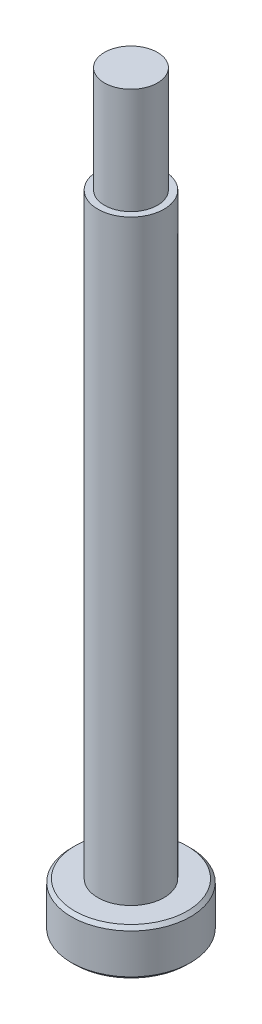
from build123d import *

# Parameters (mm, degrees)
SKETCH_1_R          = 4.5
EXTRUDE_1_DEPTH     = 3.5
SKETCH_2_R          = 2.5
EXTRUDE_2_DEPTH     = 45
SKETCH_3_R          = 2
EXTRUDE_3_DEPTH     = 8
CUT_EXTRUDE_1_DEPTH = 2.5
CHAMFER_1_SIZE      = 0.25


with BuildPart() as part:
    # 草图1 → 凸台-拉伸1 (new body)
    with BuildSketch(Plane(origin=(0, 0, 0), x_dir=(1, 0, 0), z_dir=(0, 1, 0))):
        with Locations(Location((0, 0, 0), (0, 0, 270))):
            Circle(SKETCH_1_R)
    extrude(amount=-EXTRUDE_1_DEPTH)

    # 草图2 → 凸台-拉伸2 (add)
    with BuildSketch(Plane(origin=(0, 0, 0), x_dir=(1, 0, 0), z_dir=(0, 1, 0))):
        with Locations(Location((0, 0, 0), (0, 0, 90))):
            Circle(SKETCH_2_R)
    extrude(amount=EXTRUDE_2_DEPTH)

    # 草图3 → 凸台-拉伸3 (add)
    with BuildSketch(Plane(origin=(0, 45, 0), x_dir=(1, 0, 0), z_dir=(0, 1, 0))):
        with Locations(Location((0, 0, 0), (0, 0, 270))):
            Circle(SKETCH_3_R)
    extrude(amount=EXTRUDE_3_DEPTH)

    # 草图4 → 切除-拉伸1 (cut)
    with BuildSketch(Plane.XZ.offset(3.5)):
        Polygon((1.5, -0.866025404), (1.5, 0.866025404), (0, 1.732050808), (-1.5, 0.866025404), (-1.5, -0.866025404), (0, -1.732050808), align=None)
    extrude(amount=-CUT_EXTRUDE_1_DEPTH, mode=Mode.SUBTRACT)

    # 倒角1
    chamfer_1_edges = [part.edges().sort_by_distance(p)[0] for p in [
        (0, 0, -4.5),
        (0, -3.5, -4.5),
    ]]
    chamfer(chamfer_1_edges, length=CHAMFER_1_SIZE)


solid = part.part
